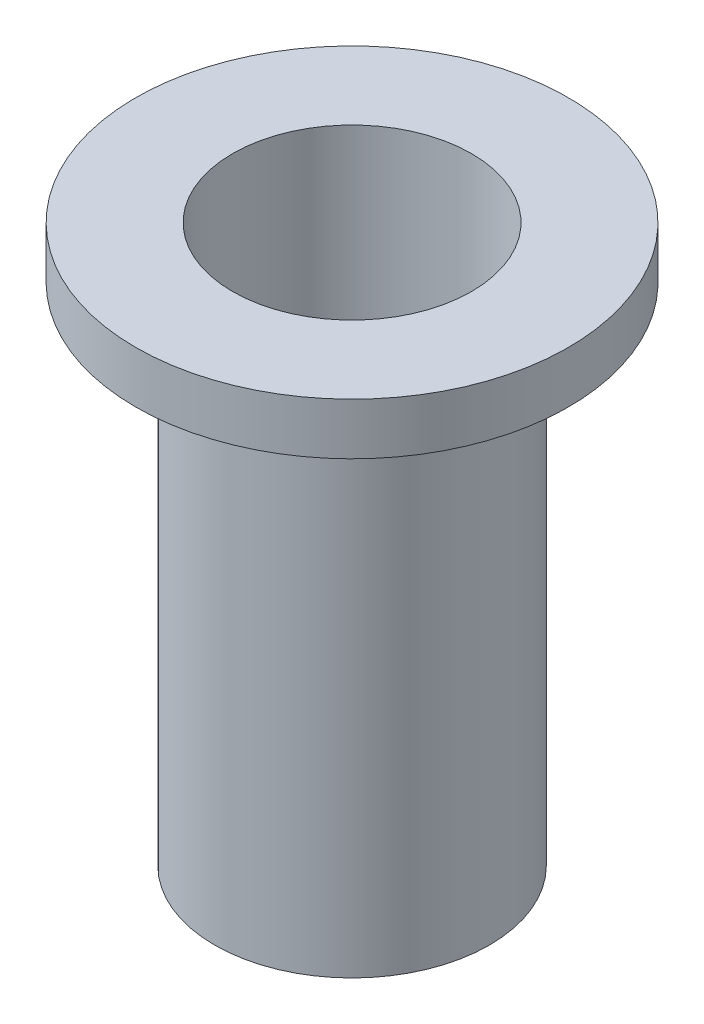
from build123d import *

# Parameters (mm, degrees)
SKETCH1_R           = 12.7
SKETCH1_R_2         = 11.049
BOSS_EXTRUDE1_DEPTH = 46.736
SKETCH2_R           = 20.0025
SKETCH2_R_2         = 11.049
BOSS_EXTRUDE2_DEPTH = 4.7752


with BuildPart() as part:
    # Sketch1 → Boss-Extrude1 (new body)
    with BuildSketch(Plane(origin=(0, 0, 0), x_dir=(1, 0, 0), z_dir=(0, 1, 0))):
        with Locations(Location((0, 0, 0), (0, 0, 270))):
            Circle(SKETCH1_R)
        with Locations(Location((0, 0, 0), (0, 0, 270))):
            Circle(SKETCH1_R_2, mode=Mode.SUBTRACT)
    extrude(amount=BOSS_EXTRUDE1_DEPTH)

    # Sketch2 → Boss-Extrude2 (add)
    with BuildSketch(Plane(origin=(0, 46.736, 0), x_dir=(1, 0, 0), z_dir=(0, 1, 0))):
        with Locations(Location((0, 0, 0), (0, 0, 270))):
            Circle(SKETCH2_R)
        with Locations(Location((0, 0, 0), (0, 0, 270))):
            Circle(SKETCH2_R_2, mode=Mode.SUBTRACT)
    extrude(amount=BOSS_EXTRUDE2_DEPTH)


solid = part.part
